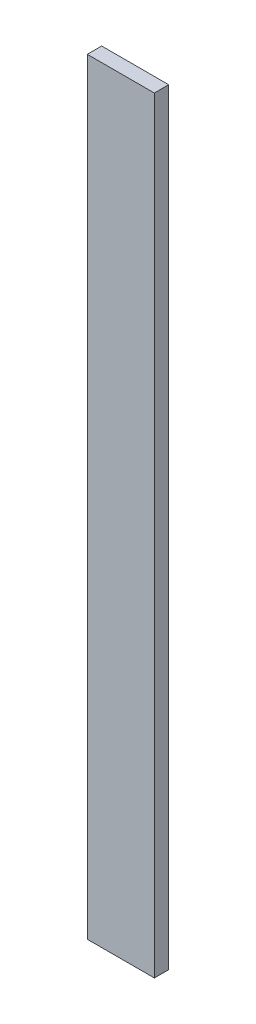
from build123d import *

# Parameters (mm, degrees)
SKETCH3_W           = 70
SKETCH3_H           = 800
BOSS_EXTRUDE1_DEPTH = 15
SKETCH4_R           = 10
CUT_EXTRUDE1_DEPTH  = 8


with BuildPart() as part:
    # Sketch3 → Boss-Extrude1 (new body)
    with BuildSketch(Plane.XY):
        with Locations((-35, -400)):
            Rectangle(SKETCH3_W, SKETCH3_H)
    extrude(amount=BOSS_EXTRUDE1_DEPTH)

    # Sketch4 → Cut-Extrude1 (cut)
    with BuildSketch(Plane(origin=(0, 0, 0), x_dir=(-1, 0, 0), z_dir=(0, 0, -1))):
        with Locations((35, -30)):
            Circle(SKETCH4_R)
        with Locations((35, -150)):
            Circle(SKETCH4_R)
        with Locations((35, -270)):
            Circle(SKETCH4_R)
        with Locations((35, -390)):
            Circle(SKETCH4_R)
        with Locations((35, -510)):
            Circle(SKETCH4_R)
        with Locations((35, -630)):
            Circle(SKETCH4_R)
        with Locations((35, -750)):
            Circle(SKETCH4_R)
    extrude(amount=-CUT_EXTRUDE1_DEPTH, mode=Mode.SUBTRACT)


solid = part.part
